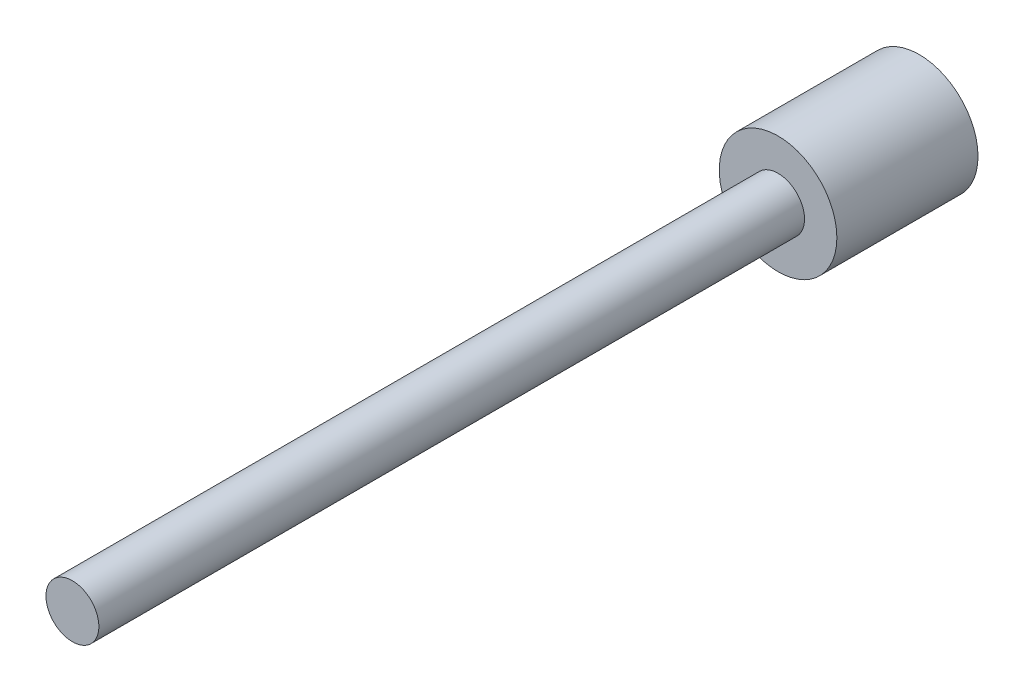
from build123d import *

# Parameters (mm, degrees)
SKETCH1_R           = 5
SKETCH1_R_2         = 1.5
BOSS_EXTRUDE1_DEPTH = 10
SKETCH2_R           = 5
BOSS_EXTRUDE2_DEPTH = 2
SKETCH3_R           = 2.25
BOSS_EXTRUDE3_DEPTH = 60


with BuildPart() as part:
    # Sketch1 → Boss-Extrude1 (new body)
    with BuildSketch(Plane.XY):
        Circle(SKETCH1_R)
        Circle(SKETCH1_R_2, mode=Mode.SUBTRACT)
    extrude(amount=BOSS_EXTRUDE1_DEPTH)

    # Sketch2 → Boss-Extrude2 (add)
    with BuildSketch(Plane.XY.offset(10)):
        Circle(SKETCH2_R)
    extrude(amount=BOSS_EXTRUDE2_DEPTH)

    # Sketch3 → Boss-Extrude3 (add)
    with BuildSketch(Plane.XY.offset(12)):
        Circle(SKETCH3_R)
    extrude(amount=BOSS_EXTRUDE3_DEPTH)


solid = part.part
